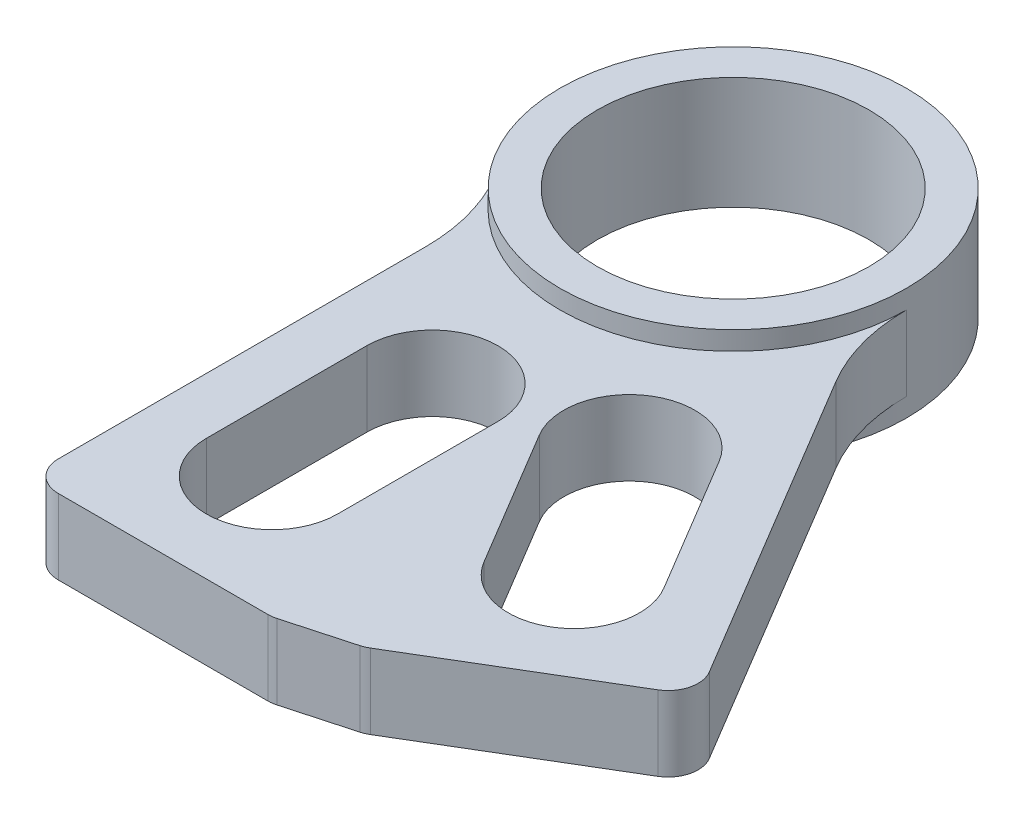
from build123d import *

# Parameters (mm, degrees)
SKETCH1_R                      = 14.6812
SKETCH1_R_2                    = 11.5062
BEARING_INSERT_EXTRUDE_DEPTH   = 4.7625
APEX_SLOT_INSERT_EXTRUDE_DEPTH = 3.175
FILLET1_R                      = 16.002
FILLET2_R                      = 2.54


with BuildPart() as part:
    # Sketch1 → Bearing_Insert_Extrude (new, symmetric)
    with BuildSketch(Plane(origin=(0, 0, 0), x_dir=(1, 0, 0), z_dir=(0, 1, 0))):
        with Locations(Location((0, 0, 0), (0, 0, 90))):
            Circle(SKETCH1_R)
        with Locations(Location((0, 0, 0), (0, 0, 90))):
            Circle(SKETCH1_R_2, mode=Mode.SUBTRACT)
    extrude(amount=BEARING_INSERT_EXTRUDE_DEPTH, both=True)

    # Sketch1<4> → Apex_Slot_Insert_Extrude (add, symmetric)
    # profile 1 of 2: a face of its own
    with BuildSketch(Plane(origin=(0, 0, 0), x_dir=(1, 0, 0), z_dir=(0, 1, 0))):
        with BuildLine():
            Line((-10.31875, -10.443228997), (-10.31875, -49.3903))
            Line((-10.31875, -49.3903), (10.31875, -49.3903))
            Line((10.31875, -49.3903), (10.31875, -37.376828003))
            Line((10.31875, -37.376828003), (16.482194895, -47.68873648))
            Line((16.482194895, -47.68873648), (34.196641747, -37.100782052))
            Line((34.196641747, -37.100782052), (14.215063896, -3.670094259))
            ThreePointArc((14.215063896, -3.670094259), (3.906936657, -14.151801278), (-10.31875, -10.443228997))
        make_face()
        with BuildLine():
            ThreePointArc((5.55625, -39.07155), (0, -44.6278), (-5.55625, -39.07155))
            Line((-5.55625, -39.07155), (-5.55625, -25.48255))
            ThreePointArc((-5.55625, -25.48255), (0, -19.9263), (5.55625, -25.48255))
            Line((5.55625, -25.48255), (5.55625, -39.07155))
        make_face(mode=Mode.SUBTRACT)
        with BuildLine():
            ThreePointArc((24.81471526, -30.686932725), (22.896044222, -38.306809993), (15.276166955, -36.388138955))
            Line((15.276166955, -36.388138955), (8.304406193, -24.723857028))
            ThreePointArc((8.304406193, -24.723857028), (10.22307723, -17.10397976), (17.842954497, -19.022650798))
            Line((17.842954497, -19.022650798), (24.81471526, -30.686932725))
        make_face(mode=Mode.SUBTRACT)
    # profile 2 of 2: a face of its own
    with BuildSketch(Plane(origin=(0, 0, 0), x_dir=(1, 0, 0), z_dir=(0, 1, 0))):
        Polygon((10.31875, -49.3903), (10.31875, -37.376828003), (16.482194895, -47.68873648), align=None)
    extrude(amount=APEX_SLOT_INSERT_EXTRUDE_DEPTH, both=True)

    # Fillet1
    fillet1_edges = [part.edges().sort_by_distance(p)[0] for p in [
        (14.215063896, 0, 3.670094259),
        (-10.31875, 0, 10.443228997),
    ]]
    fillet(fillet1_edges, radius=FILLET1_R)

    # Fillet2
    fillet2_edges = [part.edges().sort_by_distance(p)[0] for p in [
        (-10.31875, 0, 49.3903),
        (10.31875, 0, 49.3903),
        (16.482194895, 0, 47.68873648),
        (34.196641747, 0, 37.100782052),
    ]]
    fillet(fillet2_edges, radius=FILLET2_R)


solid = part.part
